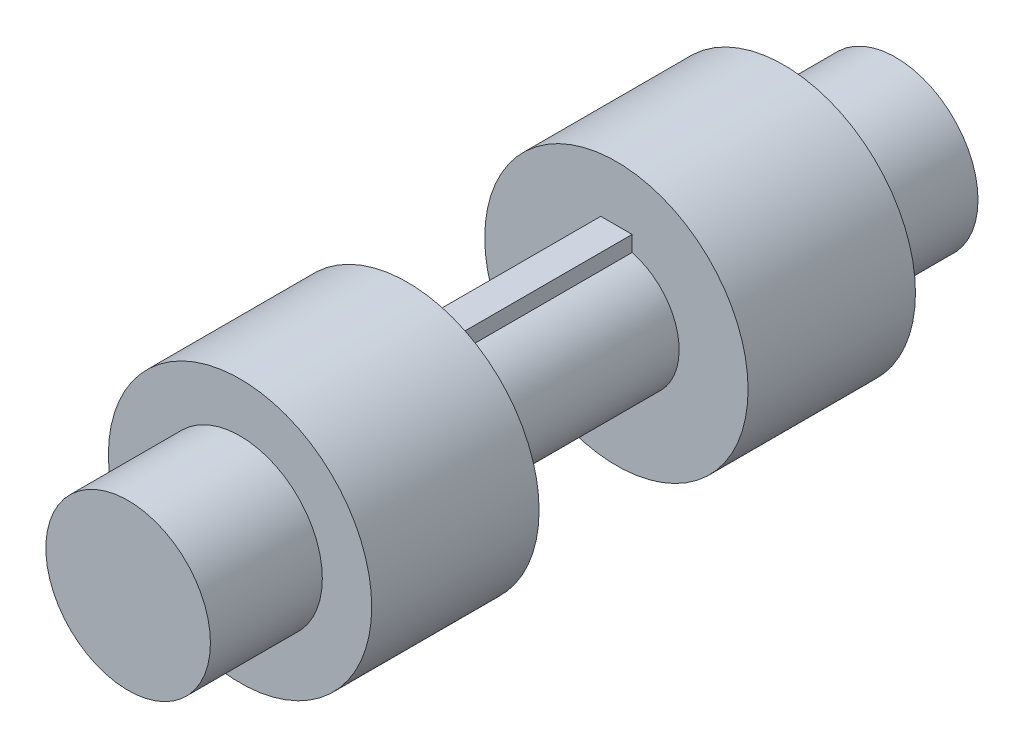
from build123d import *

# Parameters (mm, degrees)
SKETCH1_R           = 12.5
BOSS_EXTRUDE1_DEPTH = 17
SKETCH2_R           = 20
BOSS_EXTRUDE2_DEPTH = 25.425
SKETCH3_R           = 9.525
BOSS_EXTRUDE3_DEPTH = 31.75
SKETCH9_W           = 4.7625
SKETCH9_H           = 2.38125
BOSS_EXTRUDE6_DEPTH = 31.75
SKETCH4_R           = 20
BOSS_EXTRUDE4_DEPTH = 25.425
BOSS_EXTRUDE5_START = 17
SKETCH5_R           = 12.5
BOSS_EXTRUDE5_DEPTH = 17


with BuildPart() as part:
    # Sketch1 → Boss-Extrude1 (new body)
    with BuildSketch(Plane.XY):
        Circle(SKETCH1_R)
    extrude(amount=-BOSS_EXTRUDE1_DEPTH)

    # Sketch2 → Boss-Extrude2 (add)
    with BuildSketch(Plane.XY):
        with Locations(Location((0, 0, 0), (0, 0, 180))):
            Circle(SKETCH2_R)
    extrude(amount=BOSS_EXTRUDE2_DEPTH)

    # Sketch3 → Boss-Extrude3 (add)
    with BuildSketch(Plane.XY.offset(25.425)):
        Circle(SKETCH3_R)
    extrude(amount=BOSS_EXTRUDE3_DEPTH)

    # Sketch9 → Boss-Extrude6 (add)
    with BuildSketch(Plane.XY.offset(57.175)):
        with Locations((0, 10.413166593)):
            Rectangle(SKETCH9_W, SKETCH9_H)
    extrude(amount=-BOSS_EXTRUDE6_DEPTH)

    # Sketch4 → Boss-Extrude4 (add)
    with BuildSketch(Plane.XY.offset(57.175)):
        with Locations(Location((0, 0, 0), (0, 0, 180))):
            Circle(SKETCH4_R)
    extrude(amount=BOSS_EXTRUDE4_DEPTH)

    # Sketch5 → Boss-Extrude5 (add)
    with BuildSketch(Plane.XY.offset(82.6).offset(BOSS_EXTRUDE5_START)):
        Circle(SKETCH5_R)
    extrude(amount=-BOSS_EXTRUDE5_DEPTH)


solid = part.part
